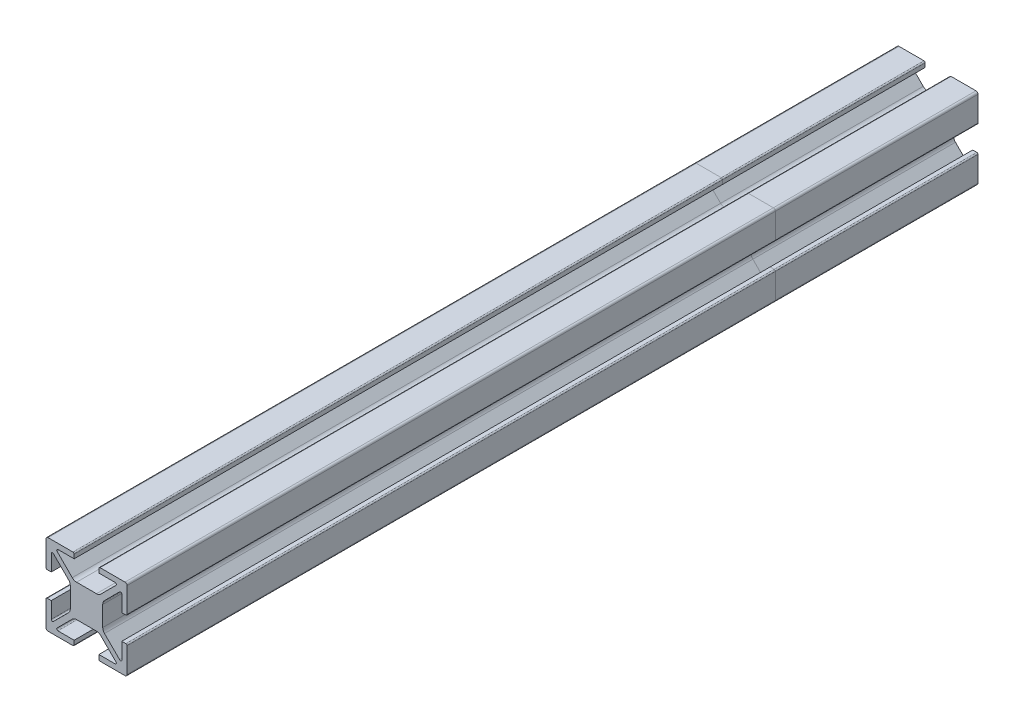
from build123d import *

# Parameters (mm, degrees)
ESBO_O11_R                                   = 2.25
QUADRADO_PF20_21_PERFIL_2020_T_SLOT_6M_DEPTH = 50
SALIENTE_EXTRUIR1_DEPTH                      = 160


with BuildPart() as part:
    # Esboço11 → Quadrado PF20-21 - PERFIL 2020 T-SLOT 6MM(1) (new body)
    with BuildSketch(Plane(origin=(0, 0, 0), x_dir=(0, -1, 0), z_dir=(0, 0, 1))):
        with BuildLine():
            Line((8.187867966, -7.26862915), (4.439339828, -3.520101013))
            ThreePointArc((4.439339828, -3.520101013), (4.114180701, -3.033465989), (4, -2.459440841))
            Line((4, -2.459440841), (4, 2.459440841))
            ThreePointArc((4, 2.459440841), (4.114180701, 3.033465989), (4.439339828, 3.520101013))
            Line((4.439339828, 3.520101013), (8.187867966, 7.26862915))
            ThreePointArc((8.187867966, 7.26862915), (8.51480503, 7.333660975), (8.7, 7.056497116))
            Line((8.7, 7.056497116), (8.7, 3.05))
            Line((8.7, 3.05), (9.7, 3.05))
            ThreePointArc((9.7, 3.05), (9.912132034, 3.137867966), (10, 3.35))
            Line((10, 3.35), (10, 9.5))
            ThreePointArc((10, 9.5), (9.853553391, 9.853553391), (9.5, 10))
            Line((9.5, 10), (3.35, 10))
            ThreePointArc((3.35, 10), (3.137867966, 9.912132034), (3.05, 9.7))
            Line((3.05, 9.7), (3.05, 8.7))
            Line((3.05, 8.7), (7.056497116, 8.7))
            ThreePointArc((7.056497116, 8.7), (7.333660975, 8.51480503), (7.26862915, 8.187867966))
            Line((7.26862915, 8.187867966), (3.520101013, 4.439339828))
            ThreePointArc((3.520101013, 4.439339828), (3.033465989, 4.114180701), (2.459440841, 4))
            Line((2.459440841, 4), (-2.459440841, 4))
            ThreePointArc((-2.459440841, 4), (-3.033465989, 4.114180701), (-3.520101013, 4.439339828))
            Line((-3.520101013, 4.439339828), (-7.26862915, 8.187867966))
            ThreePointArc((-7.26862915, 8.187867966), (-7.333660975, 8.51480503), (-7.056497116, 8.7))
            Line((-7.056497116, 8.7), (-3.05, 8.7))
            Line((-3.05, 8.7), (-3.05, 9.7))
            ThreePointArc((-3.05, 9.7), (-3.137867966, 9.912132034), (-3.35, 10))
            Line((-3.35, 10), (-9.5, 10))
            ThreePointArc((-9.5, 10), (-9.853553391, 9.853553391), (-10, 9.5))
            Line((-10, 9.5), (-10, 3.35))
            ThreePointArc((-10, 3.35), (-9.912132034, 3.137867966), (-9.7, 3.05))
            Line((-9.7, 3.05), (-8.7, 3.05))
            Line((-8.7, 3.05), (-8.7, 7.056497116))
            ThreePointArc((-8.7, 7.056497116), (-8.51480503, 7.333660975), (-8.187867966, 7.26862915))
            Line((-8.187867966, 7.26862915), (-4.439339828, 3.520101013))
            ThreePointArc((-4.439339828, 3.520101013), (-4.114180701, 3.033465989), (-4, 2.459440841))
            Line((-4, 2.459440841), (-4, -2.459440841))
            ThreePointArc((-4, -2.459440841), (-4.114180701, -3.033465989), (-4.439339828, -3.520101013))
            Line((-4.439339828, -3.520101013), (-8.187867966, -7.26862915))
            ThreePointArc((-8.187867966, -7.26862915), (-8.51480503, -7.333660975), (-8.7, -7.056497116))
            Line((-8.7, -7.056497116), (-8.7, -3.05))
            Line((-8.7, -3.05), (-9.7, -3.05))
            ThreePointArc((-9.7, -3.05), (-9.912132034, -3.137867966), (-10, -3.35))
            Line((-10, -3.35), (-10, -9.5))
            ThreePointArc((-10, -9.5), (-9.853553391, -9.853553391), (-9.5, -10))
            Line((-9.5, -10), (-3.35, -10))
            ThreePointArc((-3.35, -10), (-3.137867966, -9.912132034), (-3.05, -9.7))
            Line((-3.05, -9.7), (-3.05, -8.7))
            Line((-3.05, -8.7), (-7.056497116, -8.7))
            ThreePointArc((-7.056497116, -8.7), (-7.333660975, -8.51480503), (-7.26862915, -8.187867966))
            Line((-7.26862915, -8.187867966), (-3.520101013, -4.439339828))
            ThreePointArc((-3.520101013, -4.439339828), (-3.033465989, -4.114180701), (-2.459440841, -4))
            Line((-2.459440841, -4), (2.459440841, -4))
            ThreePointArc((2.459440841, -4), (3.033465989, -4.114180701), (3.520101013, -4.439339828))
            Line((3.520101013, -4.439339828), (7.26862915, -8.187867966))
            ThreePointArc((7.26862915, -8.187867966), (7.333660975, -8.51480503), (7.056497116, -8.7))
            Line((7.056497116, -8.7), (3.05, -8.7))
            Line((3.05, -8.7), (3.05, -9.7))
            ThreePointArc((3.05, -9.7), (3.137867966, -9.912132034), (3.35, -10))
            Line((3.35, -10), (9.5, -10))
            ThreePointArc((9.5, -10), (9.853553391, -9.853553391), (10, -9.5))
            Line((10, -9.5), (10, -3.35))
            ThreePointArc((10, -3.35), (9.912132034, -3.137867966), (9.7, -3.05))
            Line((9.7, -3.05), (8.7, -3.05))
            Line((8.7, -3.05), (8.7, -7.056497116))
            ThreePointArc((8.7, -7.056497116), (8.51480503, -7.333660975), (8.187867966, -7.26862915))
        make_face()
        Circle(ESBO_O11_R, mode=Mode.SUBTRACT)
    extrude(amount=QUADRADO_PF20_21_PERFIL_2020_T_SLOT_6M_DEPTH)


with BuildPart() as body_2:
    # Croquis1 → Saliente-Extruir1 (new body)
    with BuildSketch(Plane.XY.offset(50)):
        with BuildLine():
            Line((-7.26862915, -8.187867966), (-3.520101013, -4.439339828))
            ThreePointArc((-3.520101013, -4.439339828), (-3.033465989, -4.114180701), (-2.459440841, -4))
            Line((-2.459440841, -4), (2.459440841, -4))
            ThreePointArc((2.459440841, -4), (3.033465989, -4.114180701), (3.520101013, -4.439339828))
            Line((3.520101013, -4.439339828), (7.26862915, -8.187867966))
            ThreePointArc((7.26862915, -8.187867966), (7.333660975, -8.51480503), (7.056497116, -8.7))
            Line((7.056497116, -8.7), (3.05, -8.7))
            Line((3.05, -8.7), (3.05, -9.7))
            ThreePointArc((3.05, -9.7), (3.137867966, -9.912132034), (3.35, -10))
            Line((3.35, -10), (9.5, -10))
            ThreePointArc((9.5, -10), (9.853553391, -9.853553391), (10, -9.5))
            Line((10, -9.5), (10, -3.35))
            ThreePointArc((10, -3.35), (9.912132034, -3.137867966), (9.7, -3.05))
            Line((9.7, -3.05), (8.7, -3.05))
            Line((8.7, -3.05), (8.7, -7.056497116))
            ThreePointArc((8.7, -7.056497116), (8.51480503, -7.333660975), (8.187867966, -7.26862915))
            Line((8.187867966, -7.26862915), (4.439339828, -3.520101013))
            ThreePointArc((4.439339828, -3.520101013), (4.114180701, -3.033465989), (4, -2.459440841))
            Line((4, -2.459440841), (4, 2.459440841))
            ThreePointArc((4, 2.459440841), (4.114180701, 3.033465989), (4.439339828, 3.520101013))
            Line((4.439339828, 3.520101013), (8.187867966, 7.26862915))
            ThreePointArc((8.187867966, 7.26862915), (8.51480503, 7.333660975), (8.7, 7.056497116))
            Line((8.7, 7.056497116), (8.7, 3.05))
            Line((8.7, 3.05), (9.7, 3.05))
            ThreePointArc((9.7, 3.05), (9.912132034, 3.137867966), (10, 3.35))
            Line((10, 3.35), (10, 9.5))
            ThreePointArc((10, 9.5), (9.853553391, 9.853553391), (9.5, 10))
            Line((9.5, 10), (3.35, 10))
            ThreePointArc((3.35, 10), (3.137867966, 9.912132034), (3.05, 9.7))
            Line((3.05, 9.7), (3.05, 8.7))
            Line((3.05, 8.7), (7.056497116, 8.7))
            ThreePointArc((7.056497116, 8.7), (7.333660975, 8.51480503), (7.26862915, 8.187867966))
            Line((7.26862915, 8.187867966), (3.520101013, 4.439339828))
            ThreePointArc((3.520101013, 4.439339828), (3.033465989, 4.114180701), (2.459440841, 4))
            Line((2.459440841, 4), (-2.459440841, 4))
            ThreePointArc((-2.459440841, 4), (-3.033465989, 4.114180701), (-3.520101013, 4.439339828))
            Line((-3.520101013, 4.439339828), (-7.26862915, 8.187867966))
            ThreePointArc((-7.26862915, 8.187867966), (-7.333660975, 8.51480503), (-7.056497116, 8.7))
            Line((-7.056497116, 8.7), (-3.05, 8.7))
            Line((-3.05, 8.7), (-3.05, 9.7))
            ThreePointArc((-3.05, 9.7), (-3.137867966, 9.912132034), (-3.35, 10))
            Line((-3.35, 10), (-9.5, 10))
            ThreePointArc((-9.5, 10), (-9.853553391, 9.853553391), (-10, 9.5))
            Line((-10, 9.5), (-10, 3.35))
            ThreePointArc((-10, 3.35), (-9.912132034, 3.137867966), (-9.7, 3.05))
            Line((-9.7, 3.05), (-8.7, 3.05))
            Line((-8.7, 3.05), (-8.7, 7.056497116))
            ThreePointArc((-8.7, 7.056497116), (-8.51480503, 7.333660975), (-8.187867966, 7.26862915))
            Line((-8.187867966, 7.26862915), (-4.439339828, 3.520101013))
            ThreePointArc((-4.439339828, 3.520101013), (-4.114180701, 3.033465989), (-4, 2.459440841))
            Line((-4, 2.459440841), (-4, -2.459440841))
            ThreePointArc((-4, -2.459440841), (-4.114180701, -3.033465989), (-4.439339828, -3.520101013))
            Line((-4.439339828, -3.520101013), (-8.187867966, -7.26862915))
            ThreePointArc((-8.187867966, -7.26862915), (-8.51480503, -7.333660975), (-8.7, -7.056497116))
            Line((-8.7, -7.056497116), (-8.7, -3.05))
            Line((-8.7, -3.05), (-9.7, -3.05))
            ThreePointArc((-9.7, -3.05), (-9.912132034, -3.137867966), (-10, -3.35))
            Line((-10, -3.35), (-10, -9.5))
            ThreePointArc((-10, -9.5), (-9.853553391, -9.853553391), (-9.5, -10))
            Line((-9.5, -10), (-3.35, -10))
            ThreePointArc((-3.35, -10), (-3.137867966, -9.912132034), (-3.05, -9.7))
            Line((-3.05, -9.7), (-3.05, -8.7))
            Line((-3.05, -8.7), (-7.056497116, -8.7))
            ThreePointArc((-7.056497116, -8.7), (-7.333660975, -8.51480503), (-7.26862915, -8.187867966))
        make_face()
    extrude(amount=SALIENTE_EXTRUIR1_DEPTH)


solid = Compound([part.part, body_2.part])
